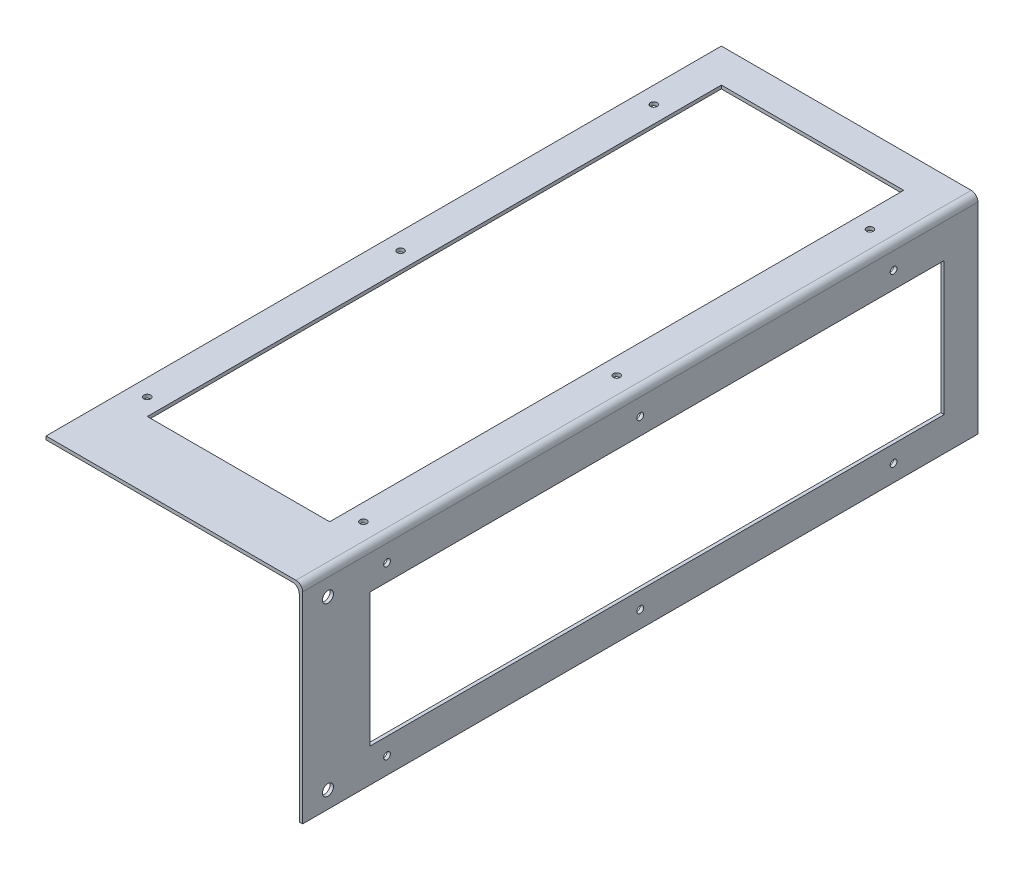
from build123d import *

# Parameters (mm, degrees)
BOSS_EXTRUDE1_DEPTH = 400
SKETCH3_W           = 340
SKETCH3_H           = 79
CUT_EXTRUDE1_DEPTH  = 2
SKETCH4_W           = 108
SKETCH4_H           = 340
CUT_EXTRUDE2_DEPTH  = 2
SKETCH6_R           = 3.25
CUT_EXTRUDE3_DEPTH  = 2
SKETCH7_R           = 2
CUT_EXTRUDE4_DEPTH  = 2
SKETCH8_R           = 2
CUT_EXTRUDE5_DEPTH  = 2


with BuildPart() as part:
    # Sketch1 → Boss-Extrude1 (new body)
    with BuildSketch(Plane.XY):
        with BuildLine():
            Line((0, 0), (0, -2))
            Line((0, -2), (146, -2))
            ThreePointArc((146, -2), (148.828427125, -3.171572875), (150, -6))
            Line((150, -6), (150, -123))
            Line((150, -123), (152, -123))
            Line((152, -123), (152, -4))
            ThreePointArc((152, -4), (150.828427125, -1.171572875), (148, 0))
            Line((148, 0), (0, 0))
        make_face()
    extrude(amount=BOSS_EXTRUDE1_DEPTH)

    # Sketch3 → Cut-Extrude1 (cut)
    with BuildSketch(Plane(origin=(152, 0, 0), x_dir=(0, 0, -1), z_dir=(1, 0, 0))):
        with Locations((-190, -63.5)):
            Rectangle(SKETCH3_W, SKETCH3_H)
    extrude(amount=-CUT_EXTRUDE1_DEPTH, mode=Mode.SUBTRACT)

    # Sketch4 → Cut-Extrude2 (cut)
    with BuildSketch(Plane(origin=(0, 0, 0), x_dir=(1, 0, 0), z_dir=(0, 1, 0))):
        with Locations((74, -190)):
            Rectangle(SKETCH4_W, SKETCH4_H)
    extrude(amount=-CUT_EXTRUDE2_DEPTH, mode=Mode.SUBTRACT)

    # Sketch6 → Cut-Extrude3 (cut)
    with BuildSketch(Plane(origin=(152, 0, 0), x_dir=(0, 0, -1), z_dir=(1, 0, 0))):
        with Locations((-385, -14)):
            Circle(SKETCH6_R)
        with Locations((-385, -113)):
            Circle(SKETCH6_R)
    extrude(amount=-CUT_EXTRUDE3_DEPTH, mode=Mode.SUBTRACT)

    # Sketch7 → Cut-Extrude4 (cut)
    with BuildSketch(Plane(origin=(0, 0, 0), x_dir=(1, 0, 0), z_dir=(0, 1, 0))):
        with Locations(Location((10, -50, 0), (0, 0, 180))):
            Circle(SKETCH7_R)
        with Locations(Location((10, -200, 0), (0, 0, 180))):
            Circle(SKETCH7_R)
        with Locations(Location((10, -350, 0), (0, 0, 180))):
            Circle(SKETCH7_R)
        with Locations(Location((138, -50, 0), (0, 0, 180))):
            Circle(SKETCH7_R)
        with Locations(Location((138, -200, 0), (0, 0, 180))):
            Circle(SKETCH7_R)
        with Locations(Location((138, -350, 0), (0, 0, 180))):
            Circle(SKETCH7_R)
    extrude(amount=-CUT_EXTRUDE4_DEPTH, mode=Mode.SUBTRACT)

    # Sketch8 → Cut-Extrude5 (cut)
    with BuildSketch(Plane(origin=(152, 0, 0), x_dir=(0, 0, -1), z_dir=(1, 0, 0))):
        with Locations((-50, -113)):
            Circle(SKETCH8_R)
        with Locations((-200, -113)):
            Circle(SKETCH8_R)
        with Locations((-350, -113)):
            Circle(SKETCH8_R)
        with Locations(Location((-350, -14, 0), (0, 0, 180))):
            Circle(SKETCH8_R)
        with Locations(Location((-200, -14, 0), (0, 0, 180))):
            Circle(SKETCH8_R)
        with Locations(Location((-50, -14, 0), (0, 0, 180))):
            Circle(SKETCH8_R)
    extrude(amount=-CUT_EXTRUDE5_DEPTH, mode=Mode.SUBTRACT)


solid = part.part
